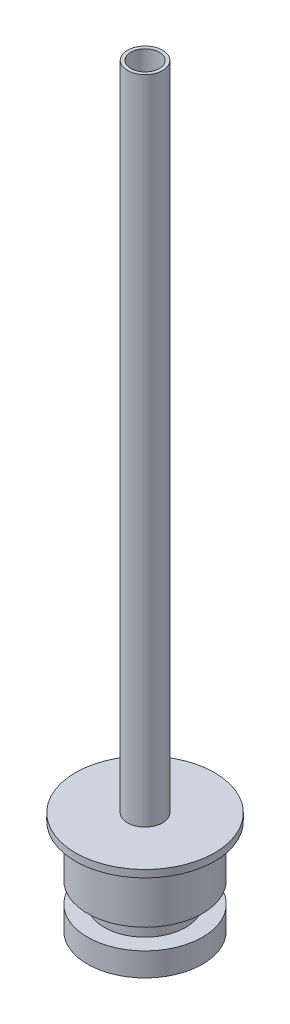
from build123d import *

# Parameters (mm, degrees)
SKETCH1_R           = 9.5
BOSS_EXTRUDE1_DEPTH = 14
SKETCH2_R           = 2.4
BOSS_EXTRUDE2_DEPTH = 89
SKETCH3_R           = 1.94
CUT_EXTRUDE1_DEPTH  = 104.872518021
SKETCH4_R           = 9.5
SKETCH4_R_2         = 7.85
CUT_EXTRUDE2_DEPTH  = 13
CUT_EXTRUDE3_START  = -3.2
SKETCH5_R           = 7.85
SKETCH5_R_2         = 5.55
CUT_EXTRUDE3_DEPTH  = 2.8


with BuildPart() as part:
    # Sketch1 → Boss-Extrude1 (new body)
    with BuildSketch(Plane(origin=(0, 0, 0), x_dir=(1, 0, 0), z_dir=(0, 1, 0))):
        with Locations(Location((0, 0, 0), (0, 0, 270))):
            Circle(SKETCH1_R)
    extrude(amount=BOSS_EXTRUDE1_DEPTH)

    # Sketch2 → Boss-Extrude2 (add)
    with BuildSketch(Plane(origin=(0, 14, 0), x_dir=(1, 0, 0), z_dir=(0, 1, 0))):
        with Locations(Location((0, 0, 0), (0, 0, 270))):
            Circle(SKETCH2_R)
    extrude(amount=BOSS_EXTRUDE2_DEPTH)

    # Sketch3 → Cut-Extrude1 (cut, through all)
    with BuildSketch(Plane(origin=(0, 103, 0), x_dir=(1, 0, 0), z_dir=(0, 1, 0))):
        with Locations(Location((0, 0, 0), (0, 0, 270))):
            Circle(SKETCH3_R)
    extrude(amount=-CUT_EXTRUDE1_DEPTH, mode=Mode.SUBTRACT)

    # Sketch4 → Cut-Extrude2 (cut)
    with BuildSketch(Plane.XZ):
        with Locations(Location((0, 0, 0), (0, 0, 270))):
            Circle(SKETCH4_R)
        with Locations(Location((0, 0, 0), (0, 0, 270))):
            Circle(SKETCH4_R_2, mode=Mode.SUBTRACT)
    extrude(amount=-CUT_EXTRUDE2_DEPTH, mode=Mode.SUBTRACT)

    # Sketch5 → Cut-Extrude3 (cut)
    with BuildSketch(Plane.XZ.offset(CUT_EXTRUDE3_START)):
        with Locations(Location((0, 0, 0), (0, 0, 270))):
            Circle(SKETCH5_R)
        with Locations(Location((0, 0, 0), (0, 0, 270))):
            Circle(SKETCH5_R_2, mode=Mode.SUBTRACT)
    extrude(amount=-CUT_EXTRUDE3_DEPTH, mode=Mode.SUBTRACT)


solid = part.part
